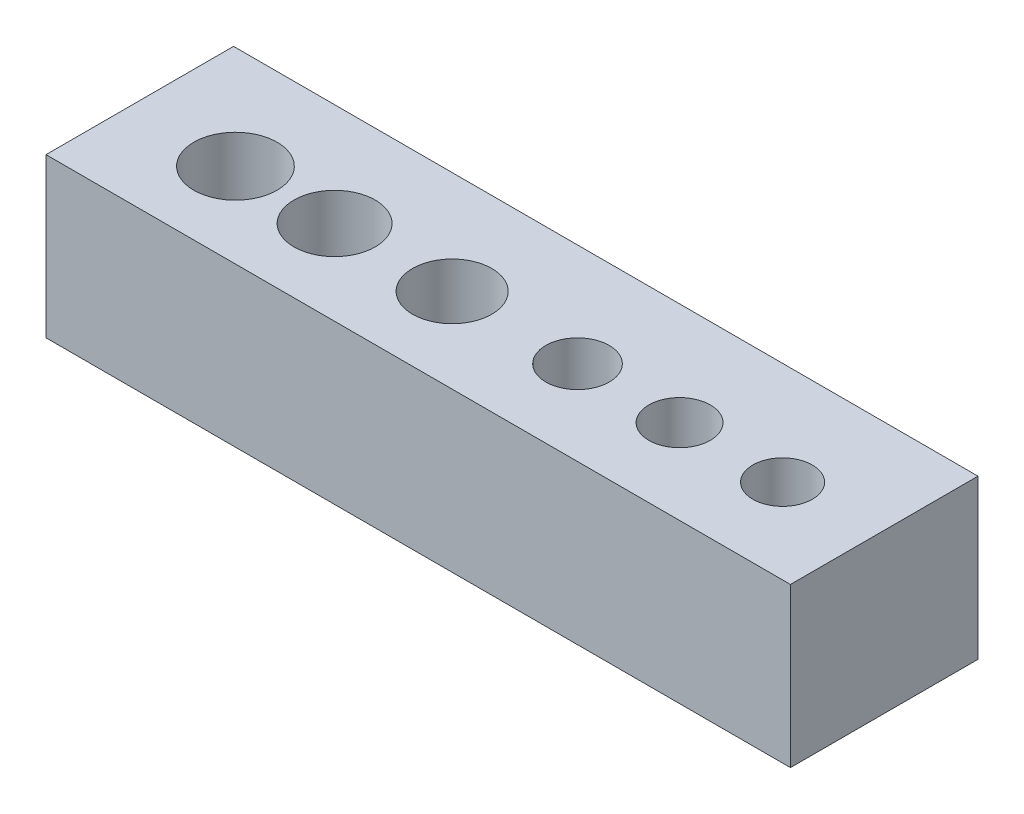
from build123d import *

# Parameters (mm, degrees)
SKETCH1_W           = 37.537915292
SKETCH1_H           = 9.45798649
SKETCH1_R           = 1.5
SKETCH1_R_2         = 1.55
SKETCH1_R_3         = 1.6
SKETCH1_R_4         = 2
SKETCH1_R_5         = 2.05
SKETCH1_R_6         = 2.1
BOSS_EXTRUDE1_DEPTH = 8


with BuildPart() as part:
    # Sketch1 → Boss-Extrude1 (new body)
    with BuildSketch(Plane(origin=(0, 0, 0), x_dir=(1, 0, 0), z_dir=(0, 1, 0))):
        with Locations((0, 0.539056225)):
            Rectangle(SKETCH1_W, SKETCH1_H)
        with Locations(Location((14.102642027, 0.080720277, 0), (0, 0, 270))):
            Circle(SKETCH1_R, mode=Mode.SUBTRACT)
        with Locations(Location((8.908100224, 0.080720277, 0), (0, 0, 270))):
            Circle(SKETCH1_R_2, mode=Mode.SUBTRACT)
        with Locations(Location((3.762563533, 0.080720277, 0), (0, 0, 270))):
            Circle(SKETCH1_R_3, mode=Mode.SUBTRACT)
        with Locations(Location((-2.559095831, 0.080720277, 0), (0, 0, 270))):
            Circle(SKETCH1_R_4, mode=Mode.SUBTRACT)
        with Locations(Location((-8.487235661, 0.080720277, 0), (0, 0, 270))):
            Circle(SKETCH1_R_5, mode=Mode.SUBTRACT)
        with Locations(Location((-13.487235661, 0.080720277, 0), (0, 0, 270))):
            Circle(SKETCH1_R_6, mode=Mode.SUBTRACT)
    extrude(amount=BOSS_EXTRUDE1_DEPTH)


solid = part.part
